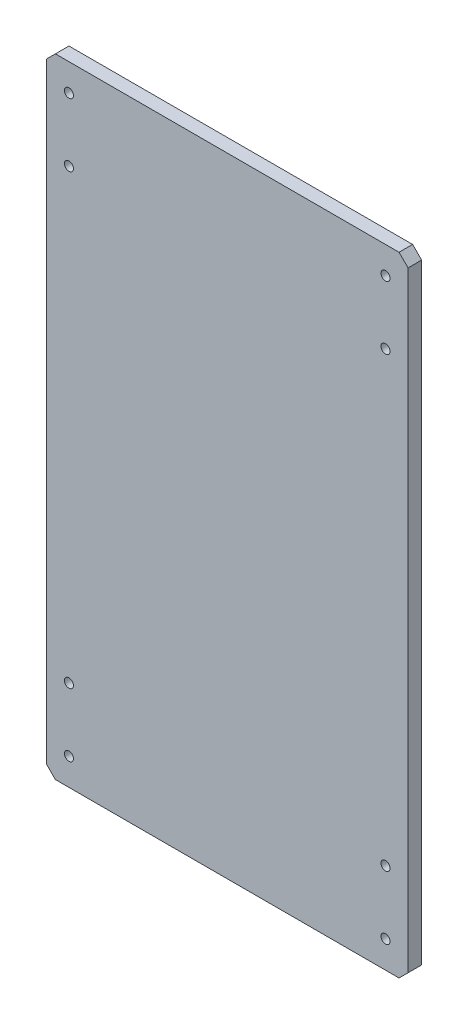
from build123d import *

# Parameters (mm, degrees)
SKETCH1_R           = 1
BOSS_EXTRUDE1_DEPTH = 3
CUT_EXTRUDE4_DEPTH  = 1.5


with BuildPart() as part:
    # Sketch1 → Boss-Extrude1 (new body)
    with BuildSketch(Plane.XY.offset(3)):
        Polygon((-38, -69.5), (38, -69.5), (40, -67.5), (40, 67.5), (38, 69.5), (-38, 69.5), (-40, 67.5), (-40, -67.5), align=None)
        with Locations(Location((35, 49.5, 0), (0, 0, 180))):
            Circle(SKETCH1_R, mode=Mode.SUBTRACT)
        with Locations(Location((-35, -63.5, 0), (0, 0, 180))):
            Circle(SKETCH1_R, mode=Mode.SUBTRACT)
        with Locations(Location((35, 63.5, 0), (0, 0, 180))):
            Circle(SKETCH1_R, mode=Mode.SUBTRACT)
        with Locations(Location((-35, -49.5, 0), (0, 0, 180))):
            Circle(SKETCH1_R, mode=Mode.SUBTRACT)
        with Locations(Location((-35, 49.5, 0), (0, 0, 180))):
            Circle(SKETCH1_R, mode=Mode.SUBTRACT)
        with Locations(Location((-35, 63.5, 0), (0, 0, 180))):
            Circle(SKETCH1_R, mode=Mode.SUBTRACT)
        with Locations(Location((35, -49.5, 0), (0, 0, 180))):
            Circle(SKETCH1_R, mode=Mode.SUBTRACT)
        with Locations(Location((35, -63.5, 0), (0, 0, 180))):
            Circle(SKETCH1_R, mode=Mode.SUBTRACT)
    extrude(amount=-BOSS_EXTRUDE1_DEPTH)

    # Sketch2 → Cut-Extrude4 (cut)
    with BuildSketch(Plane(origin=(0, 0, 0), x_dir=(-1, 0, 0), z_dir=(0, 0, -1))):
        with BuildLine():
            Line((1.706764898, 46.272292783), (1.706764898, 38.686671015))
            ThreePointArc((1.706764898, 38.686671015), (0, 36.979906118), (-1.706764898, 38.686671015))
            Line((-1.706764898, 38.686671015), (-1.706764898, 46.272292783))
            ThreePointArc((-1.706764898, 46.272292783), (0, 47.979057681), (1.706764898, 46.272292783))
        make_face()
        with BuildLine():
            Line((1.706764898, 3.792810884), (1.706764898, -3.792810884))
            ThreePointArc((1.706764898, -3.792810884), (0, -5.499575782), (-1.706764898, -3.792810884))
            Line((-1.706764898, -3.792810884), (-1.706764898, 3.792810884))
            ThreePointArc((-1.706764898, 3.792810884), (0, 5.499575782), (1.706764898, 3.792810884))
        make_face()
        with BuildLine():
            Line((-33.566376322, 46.272292783), (-33.566376322, 38.686671015))
            ThreePointArc((-33.566376322, 38.686671015), (-35.27314122, 36.979906118), (-36.979906118, 38.686671015))
            Line((-36.979906118, 38.686671015), (-36.979906118, 46.272292783))
            ThreePointArc((-36.979906118, 46.272292783), (-35.27314122, 47.979057681), (-33.566376322, 46.272292783))
        make_face()
        with BuildLine():
            Line((37.169546662, 46.272292783), (37.169546662, 38.686671015))
            ThreePointArc((37.169546662, 38.686671015), (35.462781764, 36.979906118), (33.756016866, 38.686671015))
            Line((33.756016866, 38.686671015), (33.756016866, 46.272292783))
            ThreePointArc((33.756016866, 46.272292783), (35.462781764, 47.979057681), (37.169546662, 46.272292783))
        make_face()
        with BuildLine():
            Line((1.706764898, -41.15199809), (1.706764898, -48.737619858))
            ThreePointArc((1.706764898, -48.737619858), (0, -50.444384755), (-1.706764898, -48.737619858))
            Line((-1.706764898, -48.737619858), (-1.706764898, -41.15199809))
            ThreePointArc((-1.706764898, -41.15199809), (0, -39.445233192), (1.706764898, -41.15199809))
        make_face()
        with BuildLine():
            Line((-33.566376322, -41.15199809), (-33.566376322, -48.737619858))
            ThreePointArc((-33.566376322, -48.737619858), (-35.27314122, -50.444384755), (-36.979906118, -48.737619858))
            Line((-36.979906118, -48.737619858), (-36.979906118, -41.15199809))
            ThreePointArc((-36.979906118, -41.15199809), (-35.27314122, -39.445233192), (-33.566376322, -41.15199809))
        make_face()
        with BuildLine():
            Line((-33.566376322, 3.792810884), (-33.566376322, -3.792810884))
            ThreePointArc((-33.566376322, -3.792810884), (-35.27314122, -5.499575782), (-36.979906118, -3.792810884))
            Line((-36.979906118, -3.792810884), (-36.979906118, 3.792810884))
            ThreePointArc((-36.979906118, 3.792810884), (-35.27314122, 5.499575782), (-33.566376322, 3.792810884))
        make_face()
        with BuildLine():
            Line((37.169546662, -41.15199809), (37.169546662, -48.737619858))
            ThreePointArc((37.169546662, -48.737619858), (35.462781764, -50.444384755), (33.756016866, -48.737619858))
            Line((33.756016866, -48.737619858), (33.756016866, -41.15199809))
            ThreePointArc((33.756016866, -41.15199809), (35.462781764, -39.445233192), (37.169546662, -41.15199809))
        make_face()
        with BuildLine():
            Line((37.169546662, 3.792810884), (37.169546662, -3.792810884))
            ThreePointArc((37.169546662, -3.792810884), (35.462781764, -5.499575782), (33.756016866, -3.792810884))
            Line((33.756016866, -3.792810884), (33.756016866, 3.792810884))
            ThreePointArc((33.756016866, 3.792810884), (35.462781764, 5.499575782), (37.169546662, 3.792810884))
        make_face()
    extrude(amount=-CUT_EXTRUDE4_DEPTH, mode=Mode.SUBTRACT)


solid = part.part
